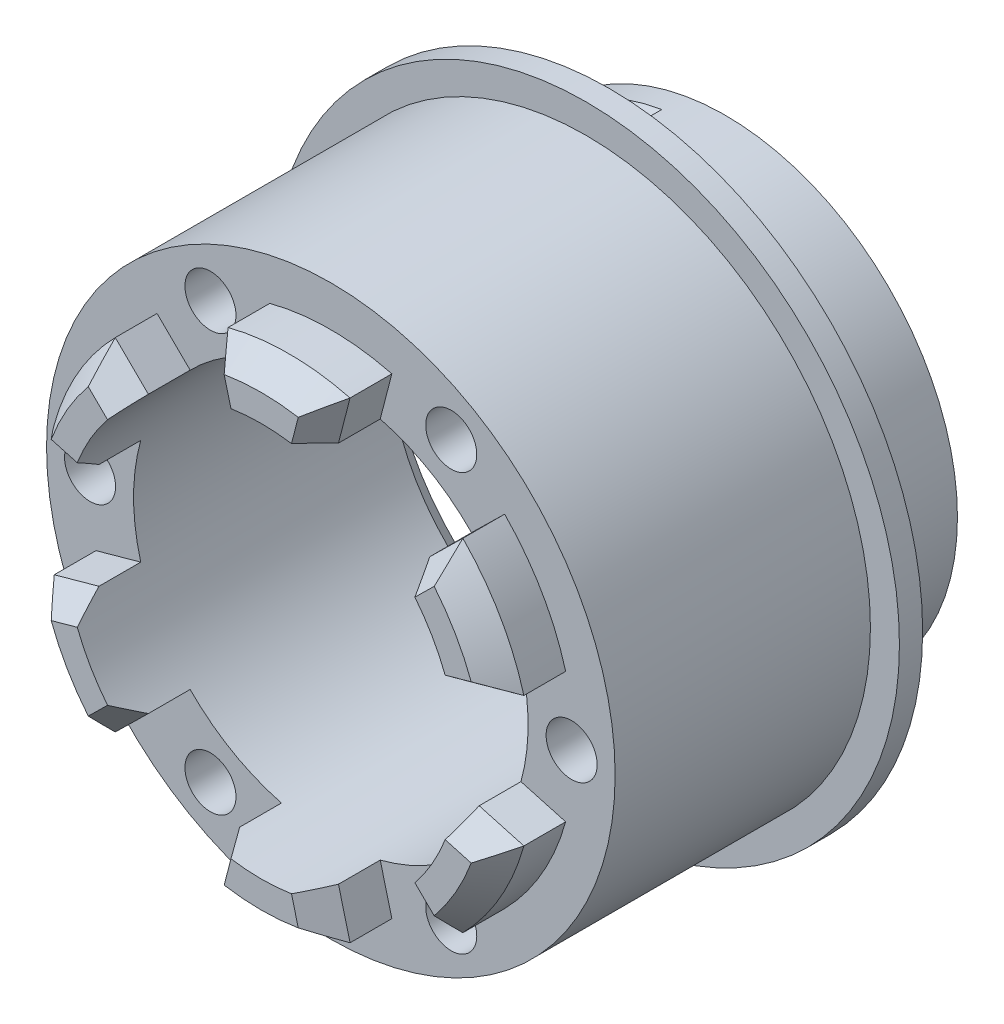
from build123d import *
from OCP.BRepFilletAPI import BRepFilletAPI_MakeChamfer

# Parameters (mm, degrees)
SKETCH_1_R          = 10
EXTRUDE_1_DEPTH     = 2
SKETCH_2_R          = 10
SKETCH_2_R_2        = 8.5
EXTRUDE_2_DEPTH     = 3
SKETCH_4_R          = 13.5
SKETCH_4_R_2        = 8.5
EXTRUDE_3_DEPTH     = 1
SKETCH_5_R          = 12.25
SKETCH_5_R_2        = 8.5
EXTRUDE_4_DEPTH     = 11
SKETCH_6_R          = 1.1
CUT_EXTRUDE_1_DEPTH = 8
SKETCH_7_R          = 3
SKETCH_7_R_2        = 1.15
CUT_EXTRUDE_2_DEPTH = 26.563646062
EXTRUDE_5_DEPTH     = 3
CHAMFER_1_SIZE      = 1.2
CHAMFER_1_SIZE2     = 0.840249046
CUT_EXTRUDE_START   = -2
CUT_EXTRUDE_3_DEPTH = 3
CHAMFER_2_SIZE      = 1


with BuildPart() as part:
    # 스케치1 → 보스-돌출1 (new body)
    with BuildSketch(Plane.XY):
        Circle(SKETCH_1_R)
    extrude(amount=EXTRUDE_1_DEPTH)

    # 스케치2 → 보스-돌출2 (add)
    with BuildSketch(Plane.XY.offset(2)):
        Circle(SKETCH_2_R)
        Circle(SKETCH_2_R_2, mode=Mode.SUBTRACT)
    extrude(amount=EXTRUDE_2_DEPTH)

    # 스케치4 → 보스-돌출3 (add)
    with BuildSketch(Plane.XY.offset(5)):
        Circle(SKETCH_4_R)
        Circle(SKETCH_4_R_2, mode=Mode.SUBTRACT)
    extrude(amount=EXTRUDE_3_DEPTH)

    # 스케치5 → 보스-돌출4 (add)
    with BuildSketch(Plane.XY.offset(6)):
        Circle(SKETCH_5_R)
        Circle(SKETCH_5_R_2, mode=Mode.SUBTRACT)
    extrude(amount=EXTRUDE_4_DEPTH)

    # 스케치6 → 컷-돌출1 (cut)
    with BuildSketch(Plane.XY.offset(17)):
        with Locations((10.375, 0)):
            Circle(SKETCH_6_R)
        with Locations((5.1875, -8.985013564)):
            Circle(SKETCH_6_R)
        with Locations((-5.1875, -8.985013564)):
            Circle(SKETCH_6_R)
        with Locations((-10.375, 0)):
            Circle(SKETCH_6_R)
        with Locations((-5.1875, 8.985013564)):
            Circle(SKETCH_6_R)
        with Locations((5.1875, 8.985013564)):
            Circle(SKETCH_6_R)
    extrude(amount=-CUT_EXTRUDE_1_DEPTH, mode=Mode.SUBTRACT)

    # 스케치7 → 컷-돌출2 (cut, through all)
    with BuildSketch(Plane(origin=(0, 0, 0), x_dir=(-1, 0, 0), z_dir=(0, 0, -1))):
        Circle(SKETCH_7_R)
        with Locations((-7, 0)):
            Circle(SKETCH_7_R_2)
        with Locations((7, 0)):
            Circle(SKETCH_7_R_2)
        with Locations((0, 7)):
            Circle(SKETCH_7_R_2)
        with Locations((0, -7)):
            Circle(SKETCH_7_R_2)
    extrude(amount=-CUT_EXTRUDE_2_DEPTH, mode=Mode.SUBTRACT)

    # 스케치10 → 보스-돌출5 (add)
    with BuildSketch(Plane.XY.offset(17)):
        with BuildLine():
            Line((-2.128230034, 8.229254943), (-2.628990043, 10.165550224))
            ThreePointArc((-2.628990043, 10.165550224), (0, 10.5), (2.628990043, 10.165550224))
            Line((2.628990043, 10.165550224), (2.128230034, 8.229254943))
            ThreePointArc((2.128230034, 8.229254943), (0, 8.5), (-2.128230034, 8.229254943))
        make_face()
        with BuildLine():
            Line((6.062628818, 5.957728747), (7.489129716, 7.359547275))
            ThreePointArc((7.489129716, 7.359547275), (9.09326674, 5.25), (10.118119759, 2.806002949))
            Line((10.118119759, 2.806002949), (8.190858852, 2.271526197))
            ThreePointArc((8.190858852, 2.271526197), (7.361215932, 4.25), (6.062628818, 5.957728747))
        make_face()
        with BuildLine():
            Line((-8.190858852, 2.271526197), (-10.118119759, 2.806002949))
            ThreePointArc((-10.118119759, 2.806002949), (-9.09326674, 5.25), (-7.489129716, 7.359547275))
            Line((-7.489129716, 7.359547275), (-6.062628818, 5.957728747))
            ThreePointArc((-6.062628818, 5.957728747), (-7.361215932, 4.25), (-8.190858852, 2.271526197))
        make_face()
        with BuildLine():
            Line((8.190858852, -2.271526197), (10.118119759, -2.806002949))
            ThreePointArc((10.118119759, -2.806002949), (9.09326674, -5.25), (7.489129716, -7.359547275))
            Line((7.489129716, -7.359547275), (6.062628818, -5.957728747))
            ThreePointArc((6.062628818, -5.957728747), (7.361215932, -4.25), (8.190858852, -2.271526197))
        make_face()
        with BuildLine():
            Line((2.128230034, -8.229254943), (2.628990043, -10.165550224))
            ThreePointArc((2.628990043, -10.165550224), (0, -10.5), (-2.628990043, -10.165550224))
            Line((-2.628990043, -10.165550224), (-2.128230034, -8.229254943))
            ThreePointArc((-2.128230034, -8.229254943), (0, -8.5), (2.128230034, -8.229254943))
        make_face()
        with BuildLine():
            Line((-6.062628818, -5.957728747), (-7.489129716, -7.359547275))
            ThreePointArc((-7.489129716, -7.359547275), (-9.09326674, -5.25), (-10.118119759, -2.806002949))
            Line((-10.118119759, -2.806002949), (-8.190858852, -2.271526197))
            ThreePointArc((-8.190858852, -2.271526197), (-7.361215932, -4.25), (-6.062628818, -5.957728747))
        make_face()
    extrude(amount=EXTRUDE_5_DEPTH)

    # 모따기1: one chamfer whose edges measure the first distance from different faces: ONE call of the kernel's chamfer builder (chamfer() names one face for all edges)
    chamfer_1_edges_1 = [part.edges().sort_by_distance(p)[0] for p in [
        (9.09326674, 5.25, 20),
    ]]
    chamfer_1_side_1 = [part.faces().sort_by_distance(p)[0] for p in [
        (9.09326674, 5.25, 18.5),
    ]]
    chamfer_1_edges_2 = [part.edges().sort_by_distance(p)[0] for p in [
        (6.775879267, 6.658638011, 20),
    ]]
    chamfer_1_side_2 = [part.faces().sort_by_distance(p)[0] for p in [
        (6.775879267, 6.658638011, 18.5),
    ]]
    chamfer_1_edges_3 = [part.edges().sort_by_distance(p)[0] for p in [
        (9.154489305, 2.538764573, 20),
    ]]
    chamfer_1_side_3 = [part.faces().sort_by_distance(p)[0] for p in [
        (9.154489305, 2.538764573, 18.5),
    ]]
    chamfer_1_edges_4 = [part.edges().sort_by_distance(p)[0] for p in [
        (-2.378610039, -9.197402584, 20),
    ]]
    chamfer_1_side_4 = [part.faces().sort_by_distance(p)[0] for p in [
        (-2.378610039, -9.197402584, 18.5),
    ]]
    chamfer_1_edges_5 = [part.edges().sort_by_distance(p)[0] for p in [
        (0, -10.5, 20),
    ]]
    chamfer_1_side_5 = [part.faces().sort_by_distance(p)[0] for p in [
        (0, -10.5, 18.5),
    ]]
    chamfer_1_edges_6 = [part.edges().sort_by_distance(p)[0] for p in [
        (2.378610039, -9.197402584, 20),
    ]]
    chamfer_1_side_6 = [part.faces().sort_by_distance(p)[0] for p in [
        (2.378610039, -9.197402584, 18.5),
    ]]
    chamfer_1_edges_7 = [part.edges().sort_by_distance(p)[0] for p in [
        (9.09326674, -5.25, 20),
    ]]
    chamfer_1_side_7 = [part.faces().sort_by_distance(p)[0] for p in [
        (9.09326674, -5.25, 18.5),
    ]]
    chamfer_1_edges_8 = [part.edges().sort_by_distance(p)[0] for p in [
        (9.154489305, -2.538764573, 20),
    ]]
    chamfer_1_side_8 = [part.faces().sort_by_distance(p)[0] for p in [
        (9.154489305, -2.538764573, 18.5),
    ]]
    chamfer_1_edges_9 = [part.edges().sort_by_distance(p)[0] for p in [
        (6.775879267, -6.658638011, 20),
    ]]
    chamfer_1_side_9 = [part.faces().sort_by_distance(p)[0] for p in [
        (6.775879267, -6.658638011, 18.5),
    ]]
    chamfer_1_edges_10 = [part.edges().sort_by_distance(p)[0] for p in [
        (2.378610039, 9.197402584, 20),
    ]]
    chamfer_1_side_10 = [part.faces().sort_by_distance(p)[0] for p in [
        (2.378610039, 9.197402584, 18.5),
    ]]
    chamfer_1_edges_11 = [part.edges().sort_by_distance(p)[0] for p in [
        (0, 10.5, 20),
    ]]
    chamfer_1_side_11 = [part.faces().sort_by_distance(p)[0] for p in [
        (0, 10.5, 18.5),
    ]]
    chamfer_1_edges_12 = [part.edges().sort_by_distance(p)[0] for p in [
        (-2.378610039, 9.197402584, 20),
    ]]
    chamfer_1_side_12 = [part.faces().sort_by_distance(p)[0] for p in [
        (-2.378610039, 9.197402584, 18.5),
    ]]
    chamfer_1_edges_13 = [part.edges().sort_by_distance(p)[0] for p in [
        (-6.775879267, 6.658638011, 20),
    ]]
    chamfer_1_side_13 = [part.faces().sort_by_distance(p)[0] for p in [
        (-6.775879267, 6.658638011, 18.5),
    ]]
    chamfer_1_edges_14 = [part.edges().sort_by_distance(p)[0] for p in [
        (-9.09326674, 5.25, 20),
    ]]
    chamfer_1_side_14 = [part.faces().sort_by_distance(p)[0] for p in [
        (-9.09326674, 5.25, 18.5),
    ]]
    chamfer_1_edges_15 = [part.edges().sort_by_distance(p)[0] for p in [
        (-9.154489305, 2.538764573, 20),
    ]]
    chamfer_1_side_15 = [part.faces().sort_by_distance(p)[0] for p in [
        (-9.154489305, 2.538764573, 18.5),
    ]]
    chamfer_1_edges_16 = [part.edges().sort_by_distance(p)[0] for p in [
        (-9.154489305, -2.538764573, 20),
    ]]
    chamfer_1_side_16 = [part.faces().sort_by_distance(p)[0] for p in [
        (-9.154489305, -2.538764573, 18.5),
    ]]
    chamfer_1_edges_17 = [part.edges().sort_by_distance(p)[0] for p in [
        (-9.09326674, -5.25, 20),
    ]]
    chamfer_1_side_17 = [part.faces().sort_by_distance(p)[0] for p in [
        (-9.09326674, -5.25, 18.5),
    ]]
    chamfer_1_edges_18 = [part.edges().sort_by_distance(p)[0] for p in [
        (-6.775879267, -6.658638011, 20),
    ]]
    chamfer_1_side_18 = [part.faces().sort_by_distance(p)[0] for p in [
        (-6.775879267, -6.658638011, 18.5),
    ]]
    chamfer_1 = BRepFilletAPI_MakeChamfer(part.part.solid().wrapped)
    for e in chamfer_1_edges_1:
        chamfer_1.Add(CHAMFER_1_SIZE, CHAMFER_1_SIZE2, e.wrapped, chamfer_1_side_1[0].wrapped)  # the first distance lies on this face
    for e in chamfer_1_edges_2:
        chamfer_1.Add(CHAMFER_1_SIZE, CHAMFER_1_SIZE2, e.wrapped, chamfer_1_side_2[0].wrapped)  # the first distance lies on this face
    for e in chamfer_1_edges_3:
        chamfer_1.Add(CHAMFER_1_SIZE, CHAMFER_1_SIZE2, e.wrapped, chamfer_1_side_3[0].wrapped)  # the first distance lies on this face
    for e in chamfer_1_edges_4:
        chamfer_1.Add(CHAMFER_1_SIZE, CHAMFER_1_SIZE2, e.wrapped, chamfer_1_side_4[0].wrapped)  # the first distance lies on this face
    for e in chamfer_1_edges_5:
        chamfer_1.Add(CHAMFER_1_SIZE, CHAMFER_1_SIZE2, e.wrapped, chamfer_1_side_5[0].wrapped)  # the first distance lies on this face
    for e in chamfer_1_edges_6:
        chamfer_1.Add(CHAMFER_1_SIZE, CHAMFER_1_SIZE2, e.wrapped, chamfer_1_side_6[0].wrapped)  # the first distance lies on this face
    for e in chamfer_1_edges_7:
        chamfer_1.Add(CHAMFER_1_SIZE, CHAMFER_1_SIZE2, e.wrapped, chamfer_1_side_7[0].wrapped)  # the first distance lies on this face
    for e in chamfer_1_edges_8:
        chamfer_1.Add(CHAMFER_1_SIZE, CHAMFER_1_SIZE2, e.wrapped, chamfer_1_side_8[0].wrapped)  # the first distance lies on this face
    for e in chamfer_1_edges_9:
        chamfer_1.Add(CHAMFER_1_SIZE, CHAMFER_1_SIZE2, e.wrapped, chamfer_1_side_9[0].wrapped)  # the first distance lies on this face
    for e in chamfer_1_edges_10:
        chamfer_1.Add(CHAMFER_1_SIZE, CHAMFER_1_SIZE2, e.wrapped, chamfer_1_side_10[0].wrapped)  # the first distance lies on this face
    for e in chamfer_1_edges_11:
        chamfer_1.Add(CHAMFER_1_SIZE, CHAMFER_1_SIZE2, e.wrapped, chamfer_1_side_11[0].wrapped)  # the first distance lies on this face
    for e in chamfer_1_edges_12:
        chamfer_1.Add(CHAMFER_1_SIZE, CHAMFER_1_SIZE2, e.wrapped, chamfer_1_side_12[0].wrapped)  # the first distance lies on this face
    for e in chamfer_1_edges_13:
        chamfer_1.Add(CHAMFER_1_SIZE, CHAMFER_1_SIZE2, e.wrapped, chamfer_1_side_13[0].wrapped)  # the first distance lies on this face
    for e in chamfer_1_edges_14:
        chamfer_1.Add(CHAMFER_1_SIZE, CHAMFER_1_SIZE2, e.wrapped, chamfer_1_side_14[0].wrapped)  # the first distance lies on this face
    for e in chamfer_1_edges_15:
        chamfer_1.Add(CHAMFER_1_SIZE, CHAMFER_1_SIZE2, e.wrapped, chamfer_1_side_15[0].wrapped)  # the first distance lies on this face
    for e in chamfer_1_edges_16:
        chamfer_1.Add(CHAMFER_1_SIZE, CHAMFER_1_SIZE2, e.wrapped, chamfer_1_side_16[0].wrapped)  # the first distance lies on this face
    for e in chamfer_1_edges_17:
        chamfer_1.Add(CHAMFER_1_SIZE, CHAMFER_1_SIZE2, e.wrapped, chamfer_1_side_17[0].wrapped)  # the first distance lies on this face
    for e in chamfer_1_edges_18:
        chamfer_1.Add(CHAMFER_1_SIZE, CHAMFER_1_SIZE2, e.wrapped, chamfer_1_side_18[0].wrapped)  # the first distance lies on this face
    add(Compound.cast(chamfer_1.Shape()), mode=Mode.REPLACE)

    # 스케치11 → 컷-돌출3 (cut)
    with BuildSketch(Plane(origin=(0, 0, 0), x_dir=(-1, 0, 0), z_dir=(0, 0, -1)).offset(CUT_EXTRUDE_START)):
        with BuildLine():
            Line((1.736481777, 9.84807753), (0.520944533, 2.954423259))
            ThreePointArc((0.520944533, 2.954423259), (2.298133329, 1.928362829), (3, 0))
            Line((3, 0), (5.85, 0))
            ThreePointArc((5.85, 0), (7, 1.15), (8.15, 0))
            Line((8.15, 0), (10, 0))
            ThreePointArc((10, 0), (7.660444431, 6.427876097), (1.736481777, 9.84807753))
        make_face()
        with BuildLine():
            ThreePointArc((3, 0), (2.298133329, -1.928362829), (0.520944533, -2.954423259))
            Line((0.520944533, -2.954423259), (1.736481777, -9.84807753))
            ThreePointArc((1.736481777, -9.84807753), (7.660444431, -6.427876097), (10, 0))
            Line((10, 0), (8.15, 0))
            ThreePointArc((8.15, 0), (7, -1.15), (5.85, 0))
            Line((5.85, 0), (3, 0))
        make_face()
    extrude(amount=-CUT_EXTRUDE_3_DEPTH, mode=Mode.SUBTRACT)

    # 모따기2
    chamfer_2_edges = [part.edges().sort_by_distance(p)[0] for p in [
        (-8.5, 0, 5),
        (-10, 0, 2),
    ]]
    chamfer(chamfer_2_edges, length=CHAMFER_2_SIZE)


solid = part.part
